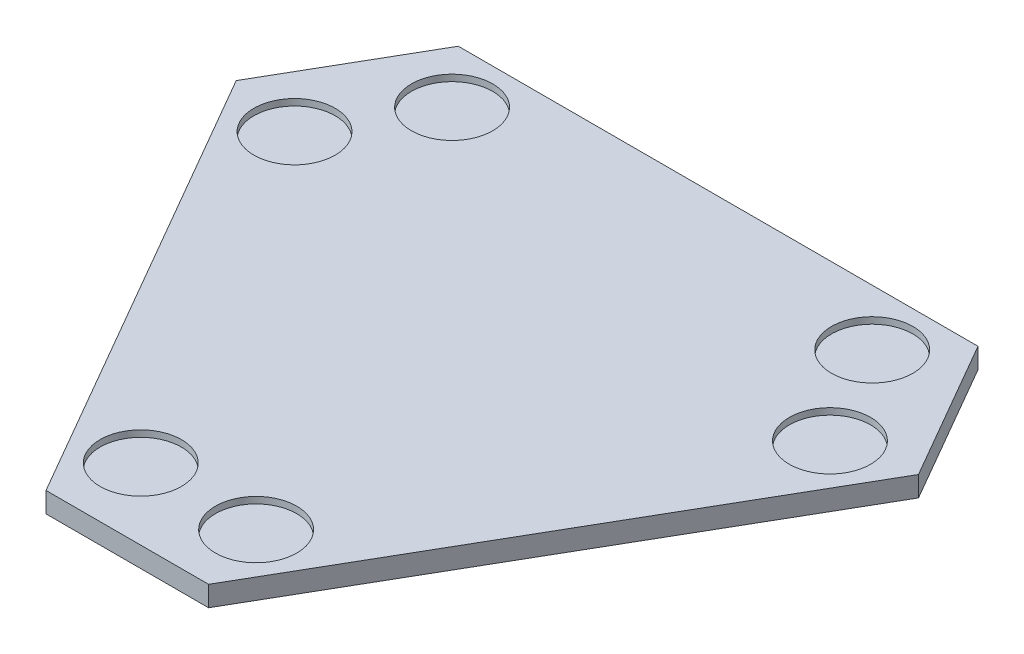
from build123d import *

# Parameters (mm, degrees)
BOSS_EXTRUDE1_DEPTH = 5
CUT_EXTRUDE4_START  = 5
SKETCH1_5_R         = 10
CUT_EXTRUDE4_DEPTH  = 1.6
CIRPATTERN1_COUNT   = 3


with BuildPart() as part:
    # Sketch1 → Boss-Extrude1 (new body)
    with BuildSketch(Plane(origin=(0, 0, 0), x_dir=(1, 0, 0), z_dir=(0, 1, 0))):
        Polygon((20, -85.358983849), (83.923048454, 25.358983849), (63.923048454, 60), (-63.923048454, 60), (-83.923048454, 25.358983849), (-20, -85.358983849), align=None)
    extrude(amount=BOSS_EXTRUDE1_DEPTH)

    # Sketch1<5> → Cut-Extrude4 (cut)
    with BuildSketch(Plane(origin=(0, 0, 0), x_dir=(1, 0, 0), z_dir=(0, 1, 0)).offset(CUT_EXTRUDE4_START)):
        with Locations(Location((-14.186994533, -67.858983849, 0), (0, 0, 270))):
            Circle(SKETCH1_5_R)
        with Locations(Location((14.186994533, -67.858983849, 0), (0, 0, 270))):
            Circle(SKETCH1_5_R)
    cut_extrude4 = extrude(amount=-CUT_EXTRUDE4_DEPTH, mode=Mode.SUBTRACT)

    # CirPattern1: Cut-Extrude4 ×3 about axis
    cirpattern1_axis = Axis((0, 0, 0), (0, 1, 0))
    for i in range(1, CIRPATTERN1_COUNT):
        add(cut_extrude4.rotate(cirpattern1_axis, i * 360 / CIRPATTERN1_COUNT), mode=Mode.SUBTRACT)


solid = part.part
